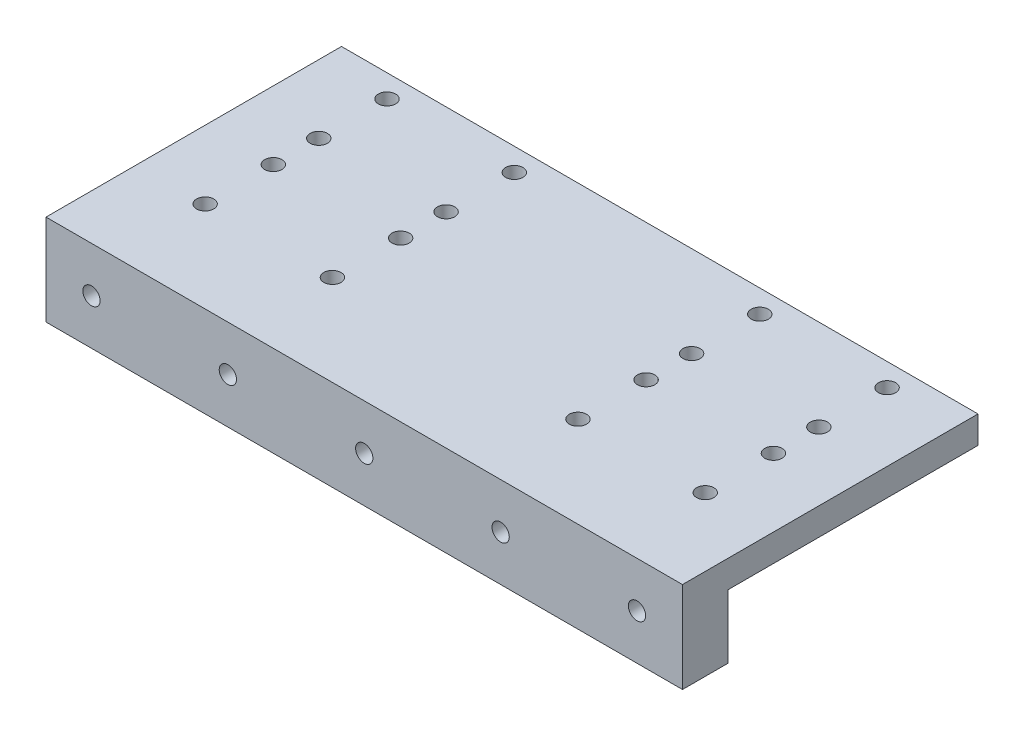
from build123d import *

# Parameters (mm, degrees)
SKETCH_1_W          = 140
SKETCH_1_H          = 20
SKETCH_1_R          = 1.9
EXTRUDE_1_DEPTH     = 10
SKETCH_2_W          = 65
SKETCH_2_H          = 6
EXTRUDE_2_DEPTH     = 140
SKETCH_3_R          = 1.9
CUT_EXTRUDE_1_DEPTH = 10


with BuildPart() as part:
    # 草图1 → 凸台-拉伸1 (new body)
    with BuildSketch(Plane.XY):
        with Locations((70, -10)):
            Rectangle(SKETCH_1_W, SKETCH_1_H)
        with Locations((10, -10)):
            Circle(SKETCH_1_R, mode=Mode.SUBTRACT)
        with Locations((40, -10)):
            Circle(SKETCH_1_R, mode=Mode.SUBTRACT)
        with Locations((70, -10)):
            Circle(SKETCH_1_R, mode=Mode.SUBTRACT)
        with Locations((100, -10)):
            Circle(SKETCH_1_R, mode=Mode.SUBTRACT)
        with Locations((130, -10)):
            Circle(SKETCH_1_R, mode=Mode.SUBTRACT)
    extrude(amount=EXTRUDE_1_DEPTH)

    # 草图2 → 凸台-拉伸2 (add, through all)
    with BuildSketch(Plane.ZY):
        with Locations((-22.5, -3)):
            Rectangle(SKETCH_2_W, SKETCH_2_H)
    extrude(amount=-EXTRUDE_2_DEPTH)

    # 草图3 → 切除-拉伸1 (cut)
    with BuildSketch(Plane.XZ.offset(6)):
        with BuildLine():
            ThreePointArc((44.9, -35), (43, -33.1), (41.1, -35))
            Line((41.1, -35), (43, -35))
            Line((43, -35), (43, -36.9))
            ThreePointArc((43, -36.9), (44.343502884, -36.343502884), (44.9, -35))
        make_face()
        with BuildLine():
            Line((43, -35), (41.1, -35))
            ThreePointArc((41.1, -35), (41.656497116, -36.343502884), (43, -36.9))
            Line((43, -36.9), (43, -35))
        make_face()
        with BuildLine():
            ThreePointArc((44.9, -50), (44.343502884, -48.656497116), (43, -48.1))
            Line((43, -48.1), (43, -50))
            Line((43, -50), (41.1, -50))
            ThreePointArc((41.1, -50), (43, -51.9), (44.9, -50))
        make_face()
        with BuildLine():
            Line((43, -50), (43, -48.1))
            ThreePointArc((43, -48.1), (41.656497116, -48.656497116), (41.1, -50))
            Line((41.1, -50), (43, -50))
        make_face()
        with BuildLine():
            ThreePointArc((16.9, -50), (16.343502884, -48.656497116), (15, -48.1))
            Line((15, -48.1), (15, -50))
            Line((15, -50), (16.9, -50))
        make_face()
        with BuildLine():
            Line((15, -50), (15, -48.1))
            ThreePointArc((15, -48.1), (13.656497116, -51.343502884), (16.9, -50))
            Line((16.9, -50), (15, -50))
        make_face()
        with BuildLine():
            Line((15, -36.9), (15, -35))
            Line((15, -35), (16.9, -35))
            ThreePointArc((16.9, -35), (13.656497116, -33.656497116), (15, -36.9))
        make_face()
        with BuildLine():
            Line((16.9, -35), (15, -35))
            Line((15, -35), (15, -36.9))
            ThreePointArc((15, -36.9), (16.343502884, -36.343502884), (16.9, -35))
        make_face()
        with Locations(Location((15, -10, 0), (0, 0, 270))):
            Circle(SKETCH_3_R)
        with Locations(Location((15, -25, 0), (0, 0, 270))):
            Circle(SKETCH_3_R)
        with Locations(Location((43, -25, 0), (0, 0, 270))):
            Circle(SKETCH_3_R)
        with Locations(Location((43, -10, 0), (0, 0, 270))):
            Circle(SKETCH_3_R)
        with Locations(Location((97, -10, 0), (0, 0, 270))):
            Circle(SKETCH_3_R)
        with Locations(Location((97, -35, 0), (0, 0, 270))):
            Circle(SKETCH_3_R)
        with Locations(Location((97, -50, 0), (0, 0, 270))):
            Circle(SKETCH_3_R)
        with Locations(Location((125, -50, 0), (0, 0, 270))):
            Circle(SKETCH_3_R)
        with Locations(Location((125, -35, 0), (0, 0, 270))):
            Circle(SKETCH_3_R)
        with Locations(Location((125, -25, 0), (0, 0, 270))):
            Circle(SKETCH_3_R)
        with Locations(Location((125, -10, 0), (0, 0, 270))):
            Circle(SKETCH_3_R)
        with Locations(Location((97, -25, 0), (0, 0, 270))):
            Circle(SKETCH_3_R)
    extrude(amount=-CUT_EXTRUDE_1_DEPTH, mode=Mode.SUBTRACT)


solid = part.part
